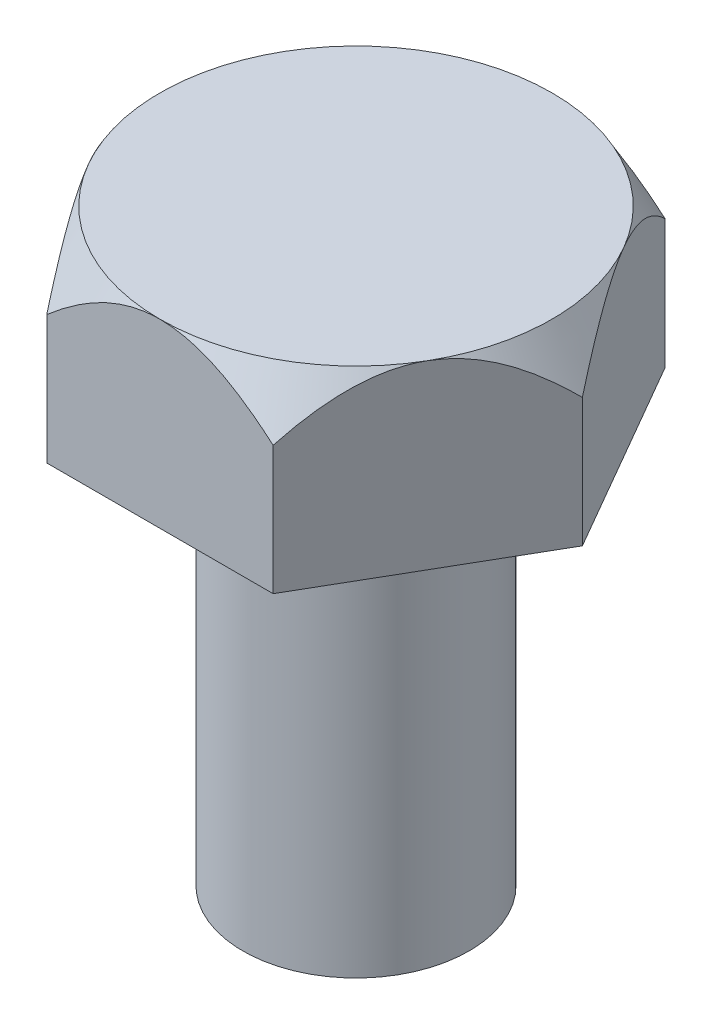
from build123d import *

# Parameters (mm, degrees)
BOSS_EXTRUDE1_DEPTH = 2
SKETCH2_OUTSIDE_W   = 24.844
SKETCH2_OUTSIDE_H   = 23.504
SKETCH2_OUTSIDE_R   = 4.330127019
CUT_EXTRUDE2_DEPTH  = 8.729812417
CUT_EXTRUDE2_DRAFT  = -30
SKETCH3_R           = 2.5
BOSS_EXTRUDE2_DEPTH = 9


with BuildPart() as part:
    # Sketch1 → Boss-Extrude1 (new, symmetric)
    with BuildSketch(Plane(origin=(0, 0, 0), x_dir=(1, 0, 0), z_dir=(0, 1, 0))):
        Polygon((5, 0), (2.5, 4.330127019), (-2.5, 4.330127019), (-5, 0), (-2.5, -4.330127019), (2.5, -4.330127019), align=None)
    extrude(amount=BOSS_EXTRUDE1_DEPTH, both=True)


with BuildPart() as cut_extrude2_tool:
    # Sketch2 outside → Cut-Extrude2 (with draft: the straight prism first)
    with BuildSketch(Plane(origin=(0, 2, 0), x_dir=(1, 0, 0), z_dir=(0, 1, 0))):
        Rectangle(SKETCH2_OUTSIDE_W, SKETCH2_OUTSIDE_H)
        Circle(SKETCH2_OUTSIDE_R, mode=Mode.SUBTRACT)
    extrude(amount=-CUT_EXTRUDE2_DEPTH)
    # Cut-Extrude2: the draft: its side faces are tilted about the plane it starts from
    cut_extrude2_sides = [cut_extrude2_tool.faces().sort_by_distance(p)[0] for p in [
        (0, -2.364906208, 11.752),
        (12.422, -2.364906208, 0),
        (0, -2.364906208, -11.752),
        (-12.422, -2.364906208, 0),
        (-4.330127019, -2.364906208, 0),
    ]]
    draft(cut_extrude2_sides, Plane(origin=(0, 2, 0), x_dir=(1, 0, 0), z_dir=(0, 1, 0)), CUT_EXTRUDE2_DRAFT)


with BuildPart() as part_1:
    add(part.part)

    # Cut-Extrude2: cut by cut_extrude2_tool
    add(cut_extrude2_tool.part, mode=Mode.SUBTRACT)

    # Sketch3 → Boss-Extrude2 (add)
    with BuildSketch(Plane.XZ.offset(2)):
        with Locations(Location((0, 0, 0), (0, 0, 270))):
            Circle(SKETCH3_R)
    extrude(amount=BOSS_EXTRUDE2_DEPTH)


solid = part_1.part
